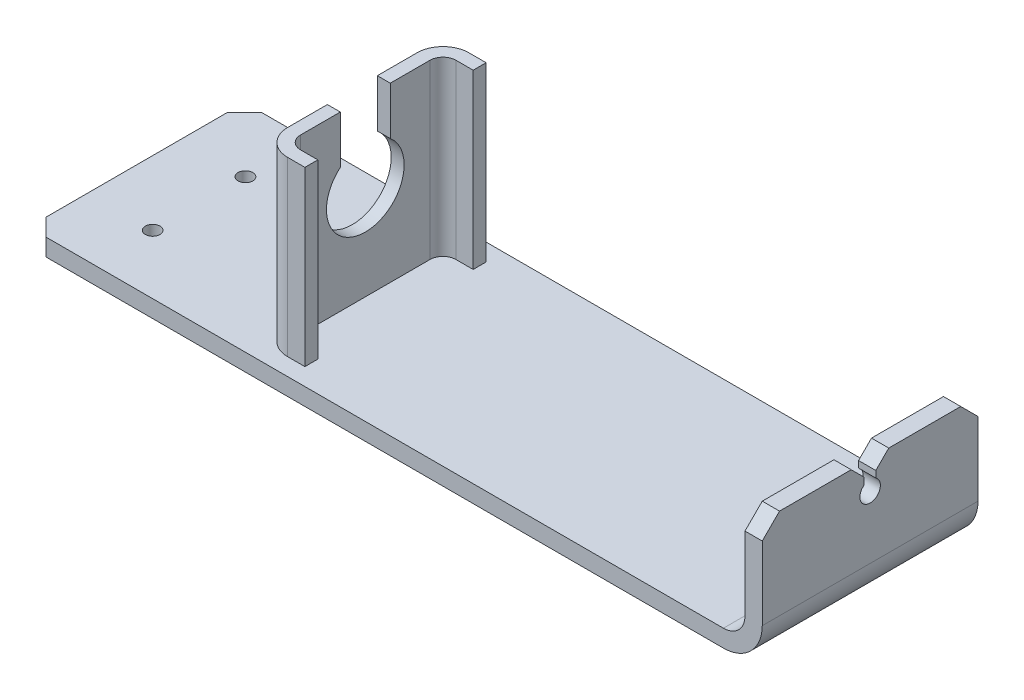
from build123d import *

# Parameters (mm, degrees)
EXTRU_MINCE1_DEPTH      = 25
EXTRU_MINCE2_DEPTH      = 40
ENL_V_MAT_EXTRU_1_REACH = 129.475
ESQUISSE3_R             = 9
CHANFREIN1_SIZE         = 4
ESQUISSE4_R             = 2.375
EXTRUSION1_DEPTH        = 10
CHANFREIN2_SIZE         = 3
EXTRUSION2_DEPTH        = 3
D_GAGEMENT_M31_D        = 3.4
D_GAGEMENT_M31_DEPTH    = 15
D_GAGEMENT_M31_TIP      = 1.021463052


with BuildPart() as part:
    # Esquisse1 → Extru.-Mince1 (new, symmetric)
    with BuildSketch(Plane.XY):
        with BuildLine():
            Line((-170, 0), (-9, 0))
            ThreePointArc((-9, 0), (-2.636038969, 2.636038969), (0, 9))
            Line((0, 9), (0, 30))
            Line((0, 30), (-4, 30))
            Line((-4, 30), (-4, 9))
            ThreePointArc((-4, 9), (-5.464466094, 5.464466094), (-9, 4))
            Line((-9, 4), (-170, 4))
            Line((-170, 4), (-170, 0))
        make_face()
    extrude(amount=EXTRU_MINCE1_DEPTH, both=True)

    # Esquisse2 → Extru.-Mince2 (add)
    with BuildSketch(Plane(origin=(0, 4, 0), x_dir=(-1, 0, 0), z_dir=(0, 1, 0))):
        with BuildLine():
            Line((110, -21), (114, -21))
            ThreePointArc((114, -21), (118.242640687, -19.242640687), (120, -15))
            Line((120, -15), (120, 15))
            ThreePointArc((120, 15), (118.242640687, 19.242640687), (114, 21))
            Line((114, 21), (110, 21))
            Line((110, 21), (110, 18))
            Line((110, 18), (114, 18))
            ThreePointArc((114, 18), (116.121320344, 17.121320344), (117, 15))
            Line((117, 15), (117, -15))
            ThreePointArc((117, -15), (116.121320344, -17.121320344), (114, -18))
            Line((114, -18), (110, -18))
            Line((110, -18), (110, -21))
        make_face()
    extrude(amount=EXTRU_MINCE2_DEPTH)

    # Esquisse3 → Enlèv. mat.-Extru.1 (cut, up to next)
    with BuildSketch(Plane(origin=(-117, 0, 0), x_dir=(0, 0, -1), z_dir=(1, 0, 0)), mode=Mode.PRIVATE) as enl_v_mat_extru_1_sk1:
        with Locations((0, 26)):
            Circle(ESQUISSE3_R)
    enl_v_mat_extru_1_tool1 = extrude(enl_v_mat_extru_1_sk1.sketch, amount=-ENL_V_MAT_EXTRU_1_REACH, mode=Mode.PRIVATE) & part.part
    add(enl_v_mat_extru_1_tool1.solids().sort_by_distance((-117, 26, 0))[0], mode=Mode.SUBTRACT)

    # Chanfrein1
    chanfrein1_edges = [part.edges().sort_by_distance(p)[0] for p in [
        (-170, 2, 25),
        (-170, 2, -25),
        (-2, 30, 25),
        (-2, 30, -25),
    ]]
    chamfer(chanfrein1_edges, length=CHANFREIN1_SIZE)

    # Esquisse4 → Extrusion1 (cut)
    with BuildSketch(Plane(origin=(0, 0, 0), x_dir=(0, 0, -1), z_dir=(1, 0, 0))):
        with Locations((0, 23.5)):
            Circle(ESQUISSE4_R)
        with BuildLine():
            Line((1.313915472, 30), (-1.386084528, 30))
            Line((-1.386084528, 30), (-1.386084528, 25.428573224))
            ThreePointArc((-1.386084528, 25.428573224), (-0.043862657, 25.874594927), (1.313915472, 25.478446646))
            Line((1.313915472, 25.478446646), (1.313915472, 30))
        make_face()
    extrude(amount=-EXTRUSION1_DEPTH, mode=Mode.SUBTRACT)

    # Chanfrein2
    chanfrein2_edges = [part.edges().sort_by_distance(p)[0] for p in [
        (-2, 30, 1.386084528),
        (-2, 30, -1.313915472),
    ]]
    chamfer(chanfrein2_edges, length=CHANFREIN2_SIZE)

    # Esquisse5 → Extrusion2 (cut)
    with BuildSketch(Plane(origin=(-117, 0, 0), x_dir=(0, 0, -1), z_dir=(1, 0, 0))):
        with BuildLine():
            Line((5.79, 44), (-5.79, 44))
            Line((-5.79, 44), (-5.79, 32.890275756))
            ThreePointArc((-5.79, 32.890275756), (0, 35), (5.79, 32.890275756))
            Line((5.79, 32.890275756), (5.79, 44))
        make_face()
    extrude(amount=-EXTRUSION2_DEPTH, mode=Mode.SUBTRACT)

    # Dégagement M31
    with Locations(Plane(origin=(-155, 4, -10.224980601), x_dir=(0, 0, 1), z_dir=(0, 1, 0))):
        with Locations((0, 0), (21.5, 0)):
            Hole(D_GAGEMENT_M31_D / 2, depth=D_GAGEMENT_M31_DEPTH)
            with Locations((0, 0, -(D_GAGEMENT_M31_DEPTH + D_GAGEMENT_M31_TIP / 2))):  # 118° drill point
                Cone(0, D_GAGEMENT_M31_D / 2, D_GAGEMENT_M31_TIP, mode=Mode.SUBTRACT)


solid = part.part
